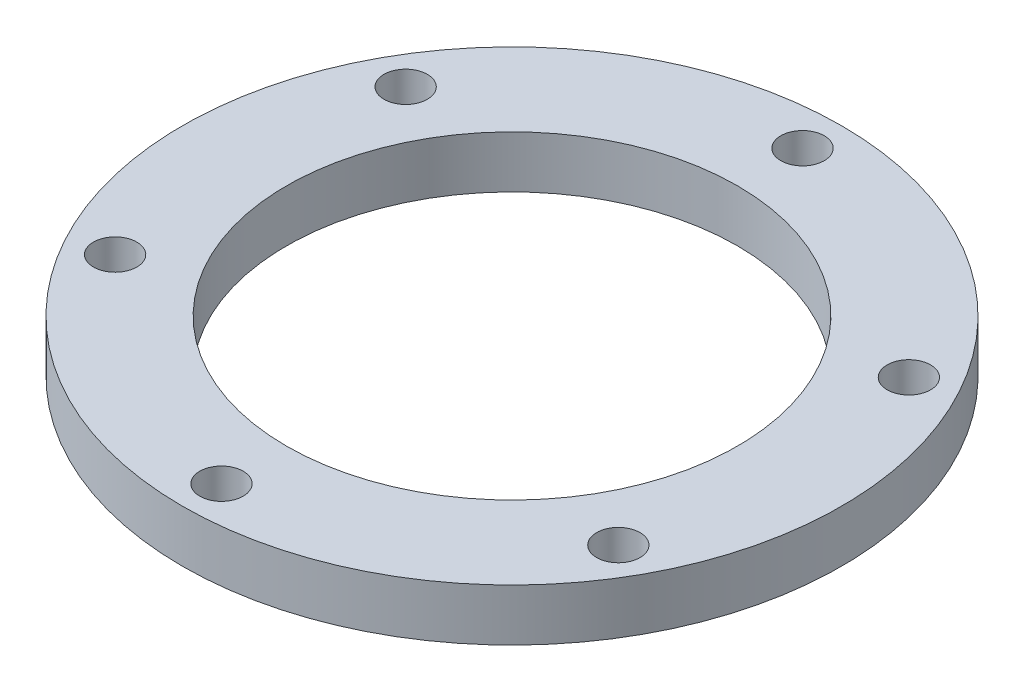
from build123d import *

# Parameters (mm, degrees)
SKETCH1_R           = 48.26
SKETCH1_R_2         = 33.02
SKETCH1_R_3         = 3.175
BOSS_EXTRUDE1_DEPTH = 7.62


with BuildPart() as part:
    # Sketch1 → Boss-Extrude1 (new body)
    with BuildSketch(Plane(origin=(0, 0, 0), x_dir=(1, 0, 0), z_dir=(0, 1, 0))):
        with Locations(Location((0, 0, 0), (0, 0, 90))):
            Circle(SKETCH1_R)
        with Locations(Location((0, 0, 0), (0, 0, 90))):
            Circle(SKETCH1_R_2, mode=Mode.SUBTRACT)
        with Locations(Location((0, 42.545, 0), (0, 0, 90))):
            Circle(SKETCH1_R_3, mode=Mode.SUBTRACT)
        with Locations(Location((36.845050804, 21.2725, 0), (0, 0, 90))):
            Circle(SKETCH1_R_3, mode=Mode.SUBTRACT)
        with Locations(Location((36.845050804, -21.2725, 0), (0, 0, 90))):
            Circle(SKETCH1_R_3, mode=Mode.SUBTRACT)
        with Locations(Location((0, -42.545, 0), (0, 0, 90))):
            Circle(SKETCH1_R_3, mode=Mode.SUBTRACT)
        with Locations(Location((-36.845050804, -21.2725, 0), (0, 0, 90))):
            Circle(SKETCH1_R_3, mode=Mode.SUBTRACT)
        with Locations(Location((-36.845050804, 21.2725, 0), (0, 0, 90))):
            Circle(SKETCH1_R_3, mode=Mode.SUBTRACT)
    extrude(amount=BOSS_EXTRUDE1_DEPTH)


solid = part.part
